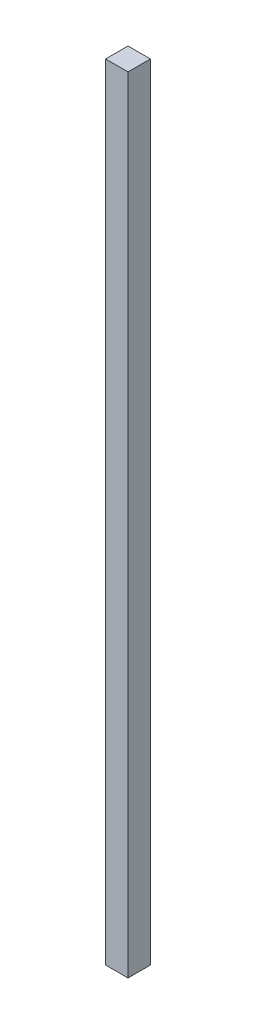
from build123d import *

# Parameters (mm, degrees)
SKETCH2_W           = 20
SKETCH2_H           = 20
BOSS_EXTRUDE1_DEPTH = 700


with BuildPart() as part:
    # Sketch2 → Boss-Extrude1 (new body)
    with BuildSketch(Plane(origin=(0, 0, 0), x_dir=(1, 0, 0), z_dir=(0, 1, 0))):
        Rectangle(SKETCH2_W, SKETCH2_H)
    extrude(amount=BOSS_EXTRUDE1_DEPTH)


solid = part.part
